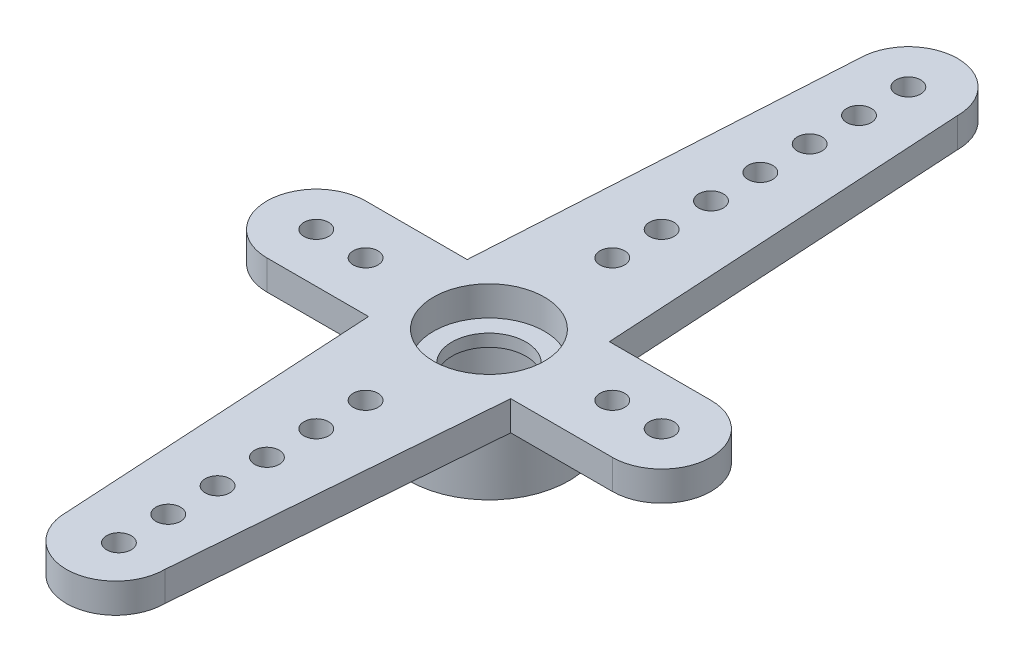
from build123d import *

# Parameters (mm, degrees)
SKETCH1_R           = 0.5
SKETCH1_R_2         = 2.25
BOSS_EXTRUDE1_DEPTH = 1.2
SKETCH2_R           = 3.25
SKETCH2_R_2         = 1.5
BOSS_EXTRUDE2_DEPTH = 2.5
SKETCH3_R           = 2.5
CUT_EXTRUDE1_DEPTH  = 2


with BuildPart() as part:
    # Sketch1 → Boss-Extrude1 (new body)
    with BuildSketch(Plane(origin=(0, 0, 0), x_dir=(1, 0, 0), z_dir=(0, 1, 0))):
        with BuildLine():
            Line((-2.882352941, 2), (-2, 17))
            ThreePointArc((-2, 17), (0, 19), (2, 17))
            Line((2, 17), (2.882352941, 2))
            Line((2.882352941, 2), (7, 2))
            ThreePointArc((7, 2), (9, 0), (7, -2))
            Line((7, -2), (2.882352941, -2))
            Line((2.882352941, -2), (1.867646984, -14.999963756))
            ThreePointArc((1.867646984, -14.999963756), (-0.132626782, -16.99941606), (-2.132352941, -14.999416075))
            Line((-2.132352941, -14.999416075), (-2.882352941, -2))
            Line((-2.882352941, -2), (-7, -2))
            ThreePointArc((-7, -2), (-9, 0), (-7, 2))
            Line((-7, 2), (-2.882352941, 2))
        make_face()
        with Locations(Location((0, 5, 0), (0, 0, 270))):
            Circle(SKETCH1_R, mode=Mode.SUBTRACT)
        with Locations(Location((0, 7, 0), (0, 0, 270))):
            Circle(SKETCH1_R, mode=Mode.SUBTRACT)
        with Locations(Location((0, 9, 0), (0, 0, 270))):
            Circle(SKETCH1_R, mode=Mode.SUBTRACT)
        with Locations(Location((0, 11, 0), (0, 0, 270))):
            Circle(SKETCH1_R, mode=Mode.SUBTRACT)
        with Locations(Location((0, 13, 0), (0, 0, 270))):
            Circle(SKETCH1_R, mode=Mode.SUBTRACT)
        with Locations(Location((0, 15, 0), (0, 0, 270))):
            Circle(SKETCH1_R, mode=Mode.SUBTRACT)
        with Locations(Location((0, 17, 0), (0, 0, 270))):
            Circle(SKETCH1_R, mode=Mode.SUBTRACT)
        with Locations(Location((0, -15, 0), (0, 0, 90))):
            Circle(SKETCH1_R, mode=Mode.SUBTRACT)
        with Locations(Location((0, -13, 0), (0, 0, 90))):
            Circle(SKETCH1_R, mode=Mode.SUBTRACT)
        with Locations(Location((0, -11, 0), (0, 0, 90))):
            Circle(SKETCH1_R, mode=Mode.SUBTRACT)
        with Locations(Location((0, -9, 0), (0, 0, 90))):
            Circle(SKETCH1_R, mode=Mode.SUBTRACT)
        with Locations(Location((0, -7, 0), (0, 0, 90))):
            Circle(SKETCH1_R, mode=Mode.SUBTRACT)
        with Locations(Location((0, -5, 0), (0, 0, 90))):
            Circle(SKETCH1_R, mode=Mode.SUBTRACT)
        with Locations(Location((7, 0, 0), (0, 0, 270))):
            Circle(SKETCH1_R, mode=Mode.SUBTRACT)
        with Locations(Location((5, 0, 0), (0, 0, 270))):
            Circle(SKETCH1_R, mode=Mode.SUBTRACT)
        with Locations(Location((-5, 0, 0), (0, 0, 90))):
            Circle(SKETCH1_R, mode=Mode.SUBTRACT)
        with Locations(Location((-7, 0, 0), (0, 0, 90))):
            Circle(SKETCH1_R, mode=Mode.SUBTRACT)
        with Locations(Location((0, 0, 0), (0, 0, 270))):
            Circle(SKETCH1_R_2, mode=Mode.SUBTRACT)
    extrude(amount=BOSS_EXTRUDE1_DEPTH)

    # Sketch2 → Boss-Extrude2 (add)
    with BuildSketch(Plane(origin=(0, 0, 0), x_dir=(1, 0, 0), z_dir=(0, 1, 0))):
        with Locations(Location((0, 0, 0), (0, 0, 270))):
            Circle(SKETCH2_R)
        with Locations(Location((0, 0, 0), (0, 0, 270))):
            Circle(SKETCH2_R_2, mode=Mode.SUBTRACT)
    extrude(amount=-BOSS_EXTRUDE2_DEPTH)

    # Sketch3 → Cut-Extrude1 (cut)
    with BuildSketch(Plane.XZ.offset(2.5)):
        with Locations(Location((0, 0, 0), (0, 0, 270))):
            Circle(SKETCH3_R)
    extrude(amount=-CUT_EXTRUDE1_DEPTH, mode=Mode.SUBTRACT)


solid = part.part
